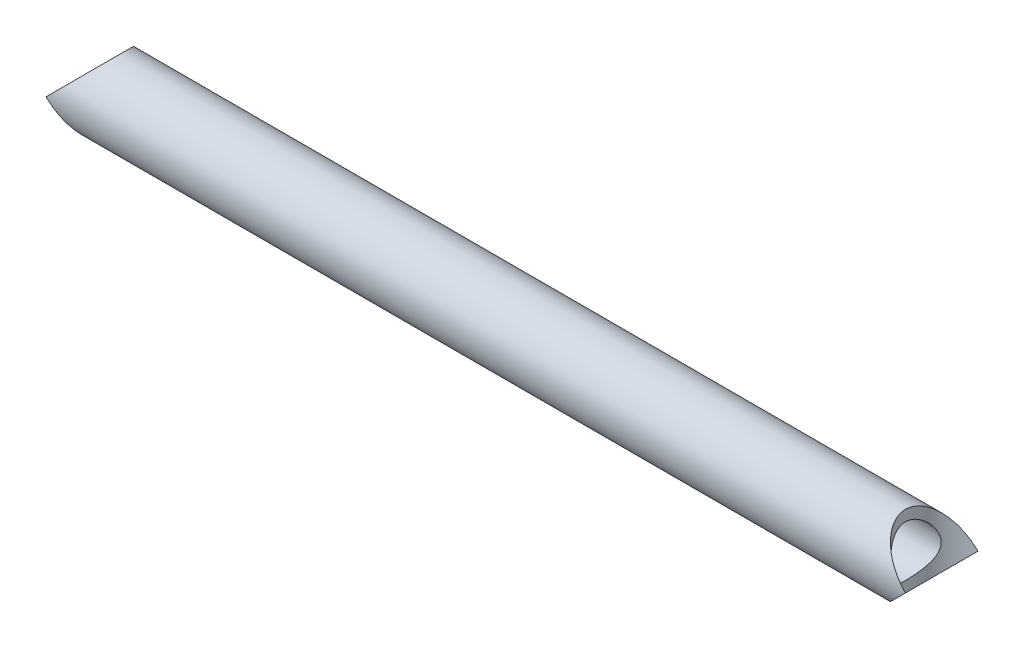
from build123d import *

# Parameters (mm, degrees)
SKETCH2_R               = 50
SKETCH2_R_2             = 35
CUT_EXTRUDE1_DEPTH      = 1187.86825621
CUT_EXTRUDE1_DEPTH_BACK = 1187.86825621
SKETCH3_R               = 50


with BuildPart() as part:
    # Sweep1: sweep along a path in Sketch1
    with BuildLine(Plane(origin=(0, 0, 0), x_dir=(1, 0, 0), z_dir=(0, 1, 0))) as sweep1_path:
        Line((0, 0), (1184.76, 0))
    # Sketch2 → Sweep1 (sweep)
    with BuildSketch(Plane(origin=(0, 0, 0), x_dir=(0, 0, -1), z_dir=(1, 0, 0))):
        Circle(SKETCH2_R)
        Circle(SKETCH2_R_2, mode=Mode.SUBTRACT)
    sweep(path=sweep1_path.line)

    # Sketch3 → Cut-Extrude1 (cut, two sides: drawn at the far end of the back side and taken through both)
    with BuildSketch(Plane(origin=(0, 0, 0), x_dir=(1, 0, 0), z_dir=(0, 1, 0)).offset(-CUT_EXTRUDE1_DEPTH_BACK)):
        Circle(SKETCH3_R)
        with Locations((1184.76, 0)):
            Circle(SKETCH3_R)
    extrude(amount=CUT_EXTRUDE1_DEPTH + CUT_EXTRUDE1_DEPTH_BACK, mode=Mode.SUBTRACT)


solid = part.part
